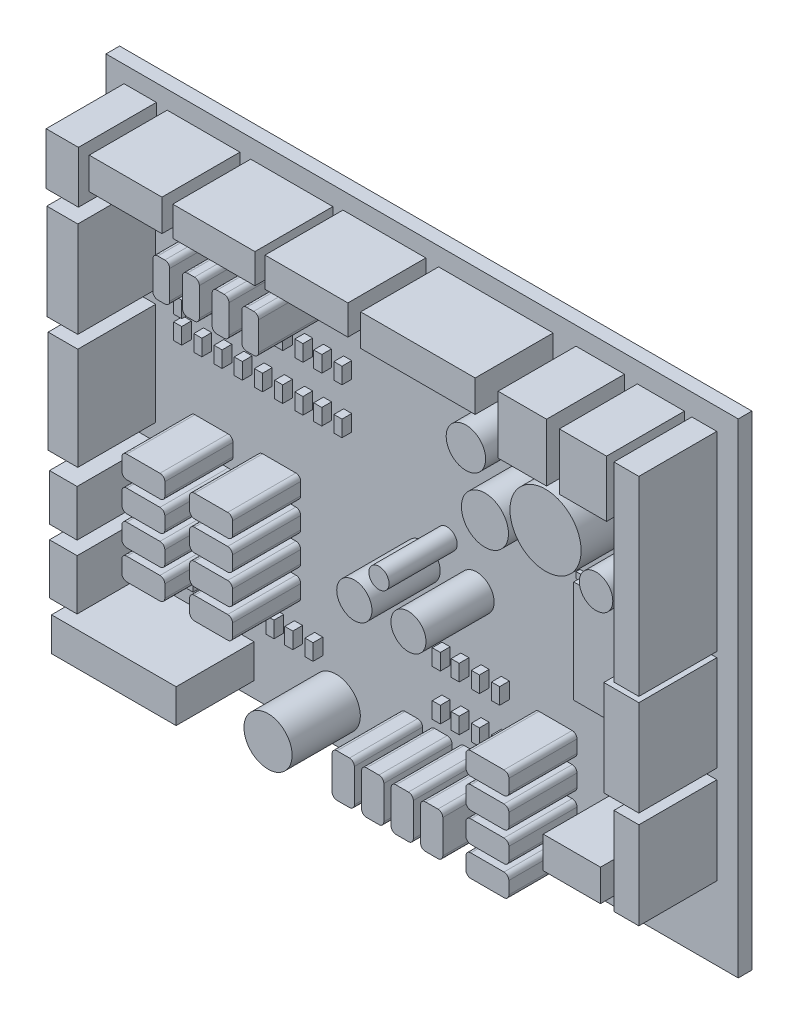
from build123d import *

# Parameters (mm, degrees)
ESQUISSE1_W       = 64.9
ESQUISSE1_H       = 49.7
EXTRUSION1_DEPTH  = 1.4
ESQUISSE2_W       = 3.318632151
ESQUISSE2_H       = 5.323639075
ESQUISSE2_W_2     = 8.503994887
ESQUISSE2_H_2     = 3.042079471
EXTRUSION2_DEPTH  = 8
ESQUISSE3_W       = 7.46692234
ESQUISSE3_H       = 3.249493981
ESQUISSE3_W_2     = 3.180355811
ESQUISSE3_H_2     = 9.817620113
ESQUISSE3_W_3     = 11.753488868
ESQUISSE3_W_4     = 4.977948227
ESQUISSE3_H_3     = 5.945882604
EXTRUSION3_DEPTH  = 8
ESQUISSE4_W       = 8.434856716
ESQUISSE4_H       = 3.042079472
ESQUISSE4_W_2     = 3.042079471
ESQUISSE4_H_2     = 10.509001811
ESQUISSE4_W_3     = 3.595184831
ESQUISSE4_H_3     = 9.817620113
EXTRUSION4_DEPTH  = 8
ESQUISSE5_W       = 2.834664963
ESQUISSE5_H       = 4.770533717
ESQUISSE5_W_2     = 4.839671887
ESQUISSE5_H_2     = 5.807606264
EXTRUSION5_DEPTH  = 8
ESQUISSE6_W       = 2.834664963
ESQUISSE6_H       = 5.185362736
EXTRUSION6_DEPTH  = 8
ESQUISSE7_W       = 2.558112283
ESQUISSE7_H       = 19.566102056
ESQUISSE7_H_2     = 8.987962075
ESQUISSE7_W_2     = 5.876744433
ESQUISSE7_H_3     = 3.249493981
ESQUISSE7_W_3     = 12.790561415
ESQUISSE7_H_4     = 3.456908491
EXTRUSION7_DEPTH  = 8
ESQUISSE8_R       = 2.470952446
ESQUISSE8_R_2     = 3.651254759
ESQUISSE8_R_3     = 2.0241223
ESQUISSE8_R_4     = 2.414892453
ESQUISSE8_R_5     = 1.717356511
ESQUISSE8_R_6     = 1.037072547
ESQUISSE8_R_7     = 1.809519071
ESQUISSE8_R_8     = 1.797592415
EXTRUSION8_DEPTH  = 7
ESQUISSE9_W       = 5.975898327
ESQUISSE9_H       = 10.512512571
EXTRUSION9_DEPTH  = 2
ESQUISSE10_W      = 1.347954655
ESQUISSE10_H      = 0.622243529
ESQUISSE10_H_2    = 0.622243528
EXTRUSION10_DEPTH = 0.4
ESQUISSE11_W      = 0.829658038
ESQUISSE11_H      = 1.659316076
ESQUISSE11_W_2    = 0.829658037
ESQUISSE11_H_2    = 1.659316075
EXTRUSION11_DEPTH = 1


with BuildPart() as part:
    # Esquisse1 → Extrusion1 (new body)
    with BuildSketch(Plane.XY):
        with Locations((32.45, 24.85)):
            Rectangle(ESQUISSE1_W, ESQUISSE1_H)
    extrude(amount=EXTRUSION1_DEPTH)

    # Esquisse2 → Extrusion2 (add)
    with BuildSketch(Plane.XY.offset(1.4)):
        with Locations((3.515675935, 45.314898263)):
            Rectangle(ESQUISSE2_W, ESQUISSE2_H)
        with Locations((28.578262491, 46.455678066)):
            Rectangle(ESQUISSE2_W_2, ESQUISSE2_H_2)
    extrude(amount=EXTRUSION2_DEPTH)

    # Esquisse3 → Extrusion3 (add)
    with BuildSketch(Plane.XY.offset(1.4)):
        with Locations((10.014663897, 46.213694472)):
            Rectangle(ESQUISSE3_W, ESQUISSE3_H)
        with Locations((3.515675934, 36.223228934)):
            Rectangle(ESQUISSE3_W_2, ESQUISSE3_H_2)
        with Locations((40.020629594, 46.213694472)):
            Rectangle(ESQUISSE3_W_3, ESQUISSE3_H)
        with Locations((50.737045915, 44.86550016)):
            Rectangle(ESQUISSE3_W_4, ESQUISSE3_H_3)
    extrude(amount=EXTRUSION3_DEPTH)

    # Esquisse4 → Extrusion4 (add)
    with BuildSketch(Plane.XY.offset(1.4)):
        with Locations((19.071764142, 46.248263556)):
            Rectangle(ESQUISSE4_W, ESQUISSE4_H)
        with Locations((3.584814105, 24.746292745)):
            Rectangle(ESQUISSE4_W_2, ESQUISSE4_H_2)
        with Locations((60.900356877, 22.464733141)):
            Rectangle(ESQUISSE4_W_3, ESQUISSE4_H_3)
    extrude(amount=EXTRUSION4_DEPTH)

    # Esquisse5 → Extrusion5 (add)
    with BuildSketch(Plane.XY.offset(1.4)):
        with Locations((3.61938319, 15.378070736)):
            Rectangle(ESQUISSE5_W, ESQUISSE5_H)
        with Locations((56.959481197, 44.72722382)):
            Rectangle(ESQUISSE5_W_2, ESQUISSE5_H_2)
    extrude(amount=EXTRUSION5_DEPTH)

    # Esquisse6 → Extrusion6 (add)
    with BuildSketch(Plane.XY.offset(1.4)):
        with Locations((3.61938319, 9.017359114)):
            Rectangle(ESQUISSE6_W, ESQUISSE6_H)
    extrude(amount=EXTRUSION6_DEPTH)

    # Esquisse7 → Extrusion7 (add)
    with BuildSketch(Plane.XY.offset(1.4)):
        with Locations((61.418893151, 37.709699585)):
            Rectangle(ESQUISSE7_W, ESQUISSE7_H)
        with Locations((61.418893151, 12.024869501)):
            Rectangle(ESQUISSE7_W, ESQUISSE7_H_2)
        with Locations((55.818701395, 9.155635454)):
            Rectangle(ESQUISSE7_W_2, ESQUISSE7_H_3)
        with Locations((8.804745926, 3.313460104)):
            Rectangle(ESQUISSE7_W_3, ESQUISSE7_H_4)
    extrude(amount=EXTRUSION7_DEPTH)

    # Esquisse8 → Extrusion8 (add)
    with BuildSketch(Plane.XY.offset(1.4)):
        with Locations(Location((23.634883349, 3.898631086, 0), (0, 0, 180))):
            Circle(ESQUISSE8_R)
        with Locations(Location((52.119809311, 36.914610632, 0), (0, 0, 180))):
            Circle(ESQUISSE8_R_2)
        with Locations(Location((43.945472462, 40.164104613, 0), (0, 0, 180))):
            Circle(ESQUISSE8_R_3)
        with Locations(Location((45.897374028, 34.702189198, 0), (0, 0, 180))):
            Circle(ESQUISSE8_R_4)
        with Locations(Location((57.305172046, 34.07994567, 0), (0, 0, 180))):
            Circle(ESQUISSE8_R_5)
        with Locations(Location((35.020629594, 24.124049217, 0), (0, 0, 180))):
            Circle(ESQUISSE8_R_6)
        with Locations(Location((32.494582934, 20.874555236, 0), (0, 0, 180))):
            Circle(ESQUISSE8_R_7)
        with Locations(Location((38.046676254, 20.874555236, 0), (0, 0, 180))):
            Circle(ESQUISSE8_R_8)
        with BuildLine():
            Line((15.354335784, 41.392558858), (16.082790029, 41.392558858))
            ThreePointArc((16.082790029, 41.392558858), (16.436343419, 41.246112249), (16.582790029, 40.892558858))
            Line((16.582790029, 40.892558858), (16.582790029, 37.983748802))
            ThreePointArc((16.582790029, 37.983748802), (16.436343419, 37.630195411), (16.082790029, 37.483748802))
            Line((16.082790029, 37.483748802), (15.354335784, 37.483748802))
            ThreePointArc((15.354335784, 37.483748802), (15.000782393, 37.630195411), (14.854335784, 37.983748802))
            Line((14.854335784, 37.983748802), (14.854335784, 40.892558858))
            ThreePointArc((14.854335784, 40.892558858), (15.000782393, 41.246112249), (15.354335784, 41.392558858))
        make_face()
        with BuildLine():
            Line((12.312256312, 41.392558858), (13.040710557, 41.392558858))
            ThreePointArc((13.040710557, 41.392558858), (13.394263948, 41.246112249), (13.540710557, 40.892558858))
            Line((13.540710557, 40.892558858), (13.540710557, 37.983748802))
            ThreePointArc((13.540710557, 37.983748802), (13.394263948, 37.630195411), (13.040710557, 37.483748802))
            Line((13.040710557, 37.483748802), (12.312256312, 37.483748802))
            ThreePointArc((12.312256312, 37.483748802), (11.958702921, 37.630195411), (11.812256312, 37.983748802))
            Line((11.812256312, 37.983748802), (11.812256312, 40.892558858))
            ThreePointArc((11.812256312, 40.892558858), (11.958702921, 41.246112249), (12.312256312, 41.392558858))
        make_face()
        with BuildLine():
            Line((18.396415255, 41.392558858), (19.1248695, 41.392558858))
            ThreePointArc((19.1248695, 41.392558858), (19.478422891, 41.246112249), (19.6248695, 40.892558858))
            Line((19.6248695, 40.892558858), (19.6248695, 37.983748802))
            ThreePointArc((19.6248695, 37.983748802), (19.478422891, 37.630195411), (19.1248695, 37.483748802))
            Line((19.1248695, 37.483748802), (18.396415255, 37.483748802))
            ThreePointArc((18.396415255, 37.483748802), (18.042861865, 37.630195411), (17.896415255, 37.983748802))
            Line((17.896415255, 37.983748802), (17.896415255, 40.892558858))
            ThreePointArc((17.896415255, 40.892558858), (18.042861865, 41.246112249), (18.396415255, 41.392558858))
        make_face()
        with BuildLine():
            Line((21.438494727, 41.392558858), (22.166948972, 41.392558858))
            ThreePointArc((22.166948972, 41.392558858), (22.520502363, 41.246112249), (22.666948972, 40.892558858))
            Line((22.666948972, 40.892558858), (22.666948972, 37.983748802))
            ThreePointArc((22.666948972, 37.983748802), (22.520502363, 37.630195411), (22.166948972, 37.483748802))
            Line((22.166948972, 37.483748802), (21.438494727, 37.483748802))
            ThreePointArc((21.438494727, 37.483748802), (21.084941336, 37.630195411), (20.938494727, 37.983748802))
            Line((20.938494727, 37.983748802), (20.938494727, 40.892558858))
            ThreePointArc((20.938494727, 40.892558858), (21.084941336, 41.246112249), (21.438494727, 41.392558858))
        make_face()
        with BuildLine():
            Line((8.631900501, 18.662133802), (8.631900501, 17.380574198))
            ThreePointArc((8.631900501, 17.380574198), (8.77834711, 17.027020808), (9.131900501, 16.880574198))
            Line((9.131900501, 16.880574198), (12.540710557, 16.880574198))
            ThreePointArc((12.540710557, 16.880574198), (12.894263948, 17.027020808), (13.040710557, 17.380574198))
            Line((13.040710557, 17.380574198), (13.040710557, 18.662133802))
            ThreePointArc((13.040710557, 18.662133802), (12.894263948, 19.015687193), (12.540710557, 19.162133802))
            Line((12.540710557, 19.162133802), (9.131900501, 19.162133802))
            ThreePointArc((9.131900501, 19.162133802), (8.77834711, 19.015687193), (8.631900501, 18.662133802))
        make_face()
        with BuildLine():
            Line((9.131900501, 22.188180462), (12.540710557, 22.188180462))
            ThreePointArc((12.540710557, 22.188180462), (12.894263948, 22.041733853), (13.040710557, 21.688180462))
            Line((13.040710557, 21.688180462), (13.040710557, 20.406620859))
            ThreePointArc((13.040710557, 20.406620859), (12.894263948, 20.053067468), (12.540710557, 19.906620859))
            Line((12.540710557, 19.906620859), (9.131900501, 19.906620859))
            ThreePointArc((9.131900501, 19.906620859), (8.77834711, 20.053067468), (8.631900501, 20.406620859))
            Line((8.631900501, 20.406620859), (8.631900501, 21.688180462))
            ThreePointArc((8.631900501, 21.688180462), (8.77834711, 22.041733853), (9.131900501, 22.188180462))
        make_face()
        with BuildLine():
            Line((8.631900501, 15.636087142), (8.631900501, 14.354527538))
            ThreePointArc((8.631900501, 14.354527538), (8.77834711, 14.000974147), (9.131900501, 13.854527538))
            Line((9.131900501, 13.854527538), (12.540710557, 13.854527538))
            ThreePointArc((12.540710557, 13.854527538), (12.894263948, 14.000974147), (13.040710557, 14.354527538))
            Line((13.040710557, 14.354527538), (13.040710557, 15.636087142))
            ThreePointArc((13.040710557, 15.636087142), (12.894263948, 15.989640532), (12.540710557, 16.136087142))
            Line((12.540710557, 16.136087142), (9.131900501, 16.136087142))
            ThreePointArc((9.131900501, 16.136087142), (8.77834711, 15.989640532), (8.631900501, 15.636087142))
        make_face()
        with BuildLine():
            Line((8.631900501, 12.610040482), (8.631900501, 11.328480878))
            ThreePointArc((8.631900501, 11.328480878), (8.77834711, 10.974927487), (9.131900501, 10.828480878))
            Line((9.131900501, 10.828480878), (12.540710557, 10.828480878))
            ThreePointArc((12.540710557, 10.828480878), (12.894263948, 10.974927487), (13.040710557, 11.328480878))
            Line((13.040710557, 11.328480878), (13.040710557, 12.610040482))
            ThreePointArc((13.040710557, 12.610040482), (12.894263948, 12.963593872), (12.540710557, 13.110040482))
            Line((12.540710557, 13.110040482), (9.131900501, 13.110040482))
            ThreePointArc((9.131900501, 13.110040482), (8.77834711, 12.963593872), (8.631900501, 12.610040482))
        make_face()
        with BuildLine():
            Line((16.082790029, 19.162133802), (19.491600085, 19.162133802))
            ThreePointArc((19.491600085, 19.162133802), (19.845153476, 19.015687193), (19.991600085, 18.662133802))
            Line((19.991600085, 18.662133802), (19.991600085, 17.380574198))
            ThreePointArc((19.991600085, 17.380574198), (19.845153476, 17.027020808), (19.491600085, 16.880574198))
            Line((19.491600085, 16.880574198), (16.082790029, 16.880574198))
            ThreePointArc((16.082790029, 16.880574198), (15.729236638, 17.027020808), (15.582790029, 17.380574198))
            Line((15.582790029, 17.380574198), (15.582790029, 18.662133802))
            ThreePointArc((15.582790029, 18.662133802), (15.729236638, 19.015687193), (16.082790029, 19.162133802))
        make_face()
        with BuildLine():
            Line((16.082790029, 13.110040482), (19.491600085, 13.110040482))
            ThreePointArc((19.491600085, 13.110040482), (19.845153476, 12.963593872), (19.991600085, 12.610040482))
            Line((19.991600085, 12.610040482), (19.991600085, 11.328480878))
            ThreePointArc((19.991600085, 11.328480878), (19.845153476, 10.974927487), (19.491600085, 10.828480878))
            Line((19.491600085, 10.828480878), (16.082790029, 10.828480878))
            ThreePointArc((16.082790029, 10.828480878), (15.729236638, 10.974927487), (15.582790029, 11.328480878))
            Line((15.582790029, 11.328480878), (15.582790029, 12.610040482))
            ThreePointArc((15.582790029, 12.610040482), (15.729236638, 12.963593872), (16.082790029, 13.110040482))
        make_face()
        with BuildLine():
            Line((19.991600085, 21.688180462), (19.991600085, 20.406620859))
            ThreePointArc((19.991600085, 20.406620859), (19.845153476, 20.053067468), (19.491600085, 19.906620859))
            Line((19.491600085, 19.906620859), (16.082790029, 19.906620859))
            ThreePointArc((16.082790029, 19.906620859), (15.729236638, 20.053067468), (15.582790029, 20.406620859))
            Line((15.582790029, 20.406620859), (15.582790029, 21.688180462))
            ThreePointArc((15.582790029, 21.688180462), (15.729236638, 22.041733853), (16.082790029, 22.188180462))
            Line((16.082790029, 22.188180462), (19.491600085, 22.188180462))
            ThreePointArc((19.491600085, 22.188180462), (19.845153476, 22.041733853), (19.991600085, 21.688180462))
        make_face()
        with BuildLine():
            Line((15.582790029, 15.636087142), (15.582790029, 14.354527538))
            ThreePointArc((15.582790029, 14.354527538), (15.729236638, 14.000974147), (16.082790029, 13.854527538))
            Line((16.082790029, 13.854527538), (19.491600085, 13.854527538))
            ThreePointArc((19.491600085, 13.854527538), (19.845153476, 14.000974147), (19.991600085, 14.354527538))
            Line((19.991600085, 14.354527538), (19.991600085, 15.636087142))
            ThreePointArc((19.991600085, 15.636087142), (19.845153476, 15.989640532), (19.491600085, 16.136087142))
            Line((19.491600085, 16.136087142), (16.082790029, 16.136087142))
            ThreePointArc((16.082790029, 16.136087142), (15.729236638, 15.989640532), (15.582790029, 15.636087142))
        make_face()
        with BuildLine():
            Line((33.23906999, 2.694226057), (33.23906999, 6.103036114))
            ThreePointArc((33.23906999, 6.103036114), (33.3855166, 6.456589504), (33.73906999, 6.603036114))
            Line((33.73906999, 6.603036114), (35.020629594, 6.603036114))
            ThreePointArc((35.020629594, 6.603036114), (35.374182985, 6.456589504), (35.520629594, 6.103036114))
            Line((35.520629594, 6.103036114), (35.520629594, 2.694226057))
            ThreePointArc((35.520629594, 2.694226057), (35.374182985, 2.340672667), (35.020629594, 2.194226057))
            Line((35.020629594, 2.194226057), (33.73906999, 2.194226057))
            ThreePointArc((33.73906999, 2.194226057), (33.3855166, 2.340672667), (33.23906999, 2.694226057))
        make_face()
        with BuildLine():
            Line((39.291163311, 2.694226057), (39.291163311, 6.103036114))
            ThreePointArc((39.291163311, 6.103036114), (39.43760992, 6.456589504), (39.791163311, 6.603036114))
            Line((39.791163311, 6.603036114), (41.072722915, 6.603036114))
            ThreePointArc((41.072722915, 6.603036114), (41.426276305, 6.456589504), (41.572722915, 6.103036114))
            Line((41.572722915, 6.103036114), (41.572722915, 2.694226057))
            ThreePointArc((41.572722915, 2.694226057), (41.426276305, 2.340672667), (41.072722915, 2.194226057))
            Line((41.072722915, 2.194226057), (39.791163311, 2.194226057))
            ThreePointArc((39.791163311, 2.194226057), (39.43760992, 2.340672667), (39.291163311, 2.694226057))
        make_face()
        with BuildLine():
            Line((30.71302333, 6.603036114), (31.994582934, 6.603036114))
            ThreePointArc((31.994582934, 6.603036114), (32.348136324, 6.456589504), (32.494582934, 6.103036114))
            Line((32.494582934, 6.103036114), (32.494582934, 2.694226057))
            ThreePointArc((32.494582934, 2.694226057), (32.348136324, 2.340672667), (31.994582934, 2.194226057))
            Line((31.994582934, 2.194226057), (30.71302333, 2.194226057))
            ThreePointArc((30.71302333, 2.194226057), (30.35946994, 2.340672667), (30.21302333, 2.694226057))
            Line((30.21302333, 2.694226057), (30.21302333, 6.103036114))
            ThreePointArc((30.21302333, 6.103036114), (30.35946994, 6.456589504), (30.71302333, 6.603036114))
        make_face()
        with BuildLine():
            Line((36.765116651, 2.194226057), (38.046676254, 2.194226057))
            ThreePointArc((38.046676254, 2.194226057), (38.400229645, 2.340672667), (38.546676254, 2.694226057))
            Line((38.546676254, 2.694226057), (38.546676254, 6.103036114))
            ThreePointArc((38.546676254, 6.103036114), (38.400229645, 6.456589504), (38.046676254, 6.603036114))
            Line((38.046676254, 6.603036114), (36.765116651, 6.603036114))
            ThreePointArc((36.765116651, 6.603036114), (36.41156326, 6.456589504), (36.265116651, 6.103036114))
            Line((36.265116651, 6.103036114), (36.265116651, 2.694226057))
            ThreePointArc((36.265116651, 2.694226057), (36.41156326, 2.340672667), (36.765116651, 2.194226057))
        make_face()
        with BuildLine():
            Line((44.445472462, 10.450724406), (47.854282518, 10.450724406))
            ThreePointArc((47.854282518, 10.450724406), (48.207835909, 10.304277797), (48.354282518, 9.950724406))
            Line((48.354282518, 9.950724406), (48.354282518, 8.669164802))
            ThreePointArc((48.354282518, 8.669164802), (48.207835909, 8.315611412), (47.854282518, 8.169164802))
            Line((47.854282518, 8.169164802), (44.445472462, 8.169164802))
            ThreePointArc((44.445472462, 8.169164802), (44.091919071, 8.315611412), (43.945472462, 8.669164802))
            Line((43.945472462, 8.669164802), (43.945472462, 9.950724406))
            ThreePointArc((43.945472462, 9.950724406), (44.091919071, 10.304277797), (44.445472462, 10.450724406))
        make_face()
        with BuildLine():
            Line((44.445472462, 4.398631086), (47.854282518, 4.398631086))
            ThreePointArc((47.854282518, 4.398631086), (48.207835909, 4.252184476), (48.354282518, 3.898631086))
            Line((48.354282518, 3.898631086), (48.354282518, 2.617071482))
            ThreePointArc((48.354282518, 2.617071482), (48.207835909, 2.263518091), (47.854282518, 2.117071482))
            Line((47.854282518, 2.117071482), (44.445472462, 2.117071482))
            ThreePointArc((44.445472462, 2.117071482), (44.091919071, 2.263518091), (43.945472462, 2.617071482))
            Line((43.945472462, 2.617071482), (43.945472462, 3.898631086))
            ThreePointArc((43.945472462, 3.898631086), (44.091919071, 4.252184476), (44.445472462, 4.398631086))
        make_face()
        with BuildLine():
            Line((48.354282518, 12.976771066), (48.354282518, 11.695211463))
            ThreePointArc((48.354282518, 11.695211463), (48.207835909, 11.341658072), (47.854282518, 11.195211463))
            Line((47.854282518, 11.195211463), (44.445472462, 11.195211463))
            ThreePointArc((44.445472462, 11.195211463), (44.091919071, 11.341658072), (43.945472462, 11.695211463))
            Line((43.945472462, 11.695211463), (43.945472462, 12.976771066))
            ThreePointArc((43.945472462, 12.976771066), (44.091919071, 13.330324457), (44.445472462, 13.476771066))
            Line((44.445472462, 13.476771066), (47.854282518, 13.476771066))
            ThreePointArc((47.854282518, 13.476771066), (48.207835909, 13.330324457), (48.354282518, 12.976771066))
        make_face()
        with BuildLine():
            Line((43.945472462, 6.924677746), (43.945472462, 5.643118142))
            ThreePointArc((43.945472462, 5.643118142), (44.091919071, 5.289564752), (44.445472462, 5.143118142))
            Line((44.445472462, 5.143118142), (47.854282518, 5.143118142))
            ThreePointArc((47.854282518, 5.143118142), (48.207835909, 5.289564752), (48.354282518, 5.643118142))
            Line((48.354282518, 5.643118142), (48.354282518, 6.924677746))
            ThreePointArc((48.354282518, 6.924677746), (48.207835909, 7.278231136), (47.854282518, 7.424677746))
            Line((47.854282518, 7.424677746), (44.445472462, 7.424677746))
            ThreePointArc((44.445472462, 7.424677746), (44.091919071, 7.278231136), (43.945472462, 6.924677746))
        make_face()
    extrude(amount=EXTRUSION8_DEPTH)

    # Esquisse9 → Extrusion9 (add)
    with BuildSketch(Plane.XY.offset(1.4)):
        with Locations((52.998804639, 23.511126475)):
            Rectangle(ESQUISSE9_W, ESQUISSE9_H)
    extrude(amount=EXTRUSION9_DEPTH)

    # Esquisse10 → Extrusion10 (add)
    with BuildSketch(Plane.XY.offset(1.4)):
        with Locations((49.336878148, 27.892079472)):
            Rectangle(ESQUISSE10_W, ESQUISSE10_H)
        with Locations((49.336878148, 26.509316076)):
            Rectangle(ESQUISSE10_W, ESQUISSE10_H)
        with Locations((49.336878148, 25.126552679)):
            Rectangle(ESQUISSE10_W, ESQUISSE10_H_2)
        with Locations((49.336878148, 23.743789283)):
            Rectangle(ESQUISSE10_W, ESQUISSE10_H_2)
        with Locations((49.336878148, 22.361025887)):
            Rectangle(ESQUISSE10_W, ESQUISSE10_H_2)
        with Locations((49.336878148, 20.978262491)):
            Rectangle(ESQUISSE10_W, ESQUISSE10_H_2)
        with Locations((49.336878148, 19.595499094)):
            Rectangle(ESQUISSE10_W, ESQUISSE10_H)
        with Locations((56.66073113, 19.595499094)):
            Rectangle(ESQUISSE10_W, ESQUISSE10_H)
        with Locations((56.66073113, 20.978262491)):
            Rectangle(ESQUISSE10_W, ESQUISSE10_H_2)
        with Locations((56.66073113, 22.361025887)):
            Rectangle(ESQUISSE10_W, ESQUISSE10_H_2)
        with Locations((56.66073113, 23.743789283)):
            Rectangle(ESQUISSE10_W, ESQUISSE10_H_2)
        with Locations((56.66073113, 25.126552679)):
            Rectangle(ESQUISSE10_W, ESQUISSE10_H_2)
        with Locations((56.66073113, 26.509316076)):
            Rectangle(ESQUISSE10_W, ESQUISSE10_H)
        with Locations((56.66073113, 27.892079472)):
            Rectangle(ESQUISSE10_W, ESQUISSE10_H)
    extrude(amount=EXTRUSION10_DEPTH)

    # Esquisse11 → Extrusion11 (add)
    with BuildSketch(Plane.XY.offset(1.4)):
        with Locations((10.429492916, 34.218222009)):
            Rectangle(ESQUISSE11_W, ESQUISSE11_H)
        with Locations((8.355347822, 34.218222009)):
            Rectangle(ESQUISSE11_W_2, ESQUISSE11_H)
        with Locations((12.50363801, 34.218222009)):
            Rectangle(ESQUISSE11_W, ESQUISSE11_H)
        with Locations((14.577783104, 34.218222009)):
            Rectangle(ESQUISSE11_W, ESQUISSE11_H)
        with Locations((16.651928199, 34.218222009)):
            Rectangle(ESQUISSE11_W_2, ESQUISSE11_H)
        with Locations((18.726073293, 34.218222009)):
            Rectangle(ESQUISSE11_W, ESQUISSE11_H)
        with Locations((20.800218387, 34.218222009)):
            Rectangle(ESQUISSE11_W, ESQUISSE11_H)
        with Locations((8.355347822, 31.867524236)):
            Rectangle(ESQUISSE11_W_2, ESQUISSE11_H_2)
        with Locations((8.355347822, 29.516826462)):
            Rectangle(ESQUISSE11_W_2, ESQUISSE11_H)
        with Locations((10.429492916, 29.516826462)):
            Rectangle(ESQUISSE11_W, ESQUISSE11_H)
        with Locations((12.50363801, 29.516826462)):
            Rectangle(ESQUISSE11_W, ESQUISSE11_H)
        with Locations((14.577783104, 29.516826462)):
            Rectangle(ESQUISSE11_W, ESQUISSE11_H)
        with Locations((16.651928199, 29.516826462)):
            Rectangle(ESQUISSE11_W_2, ESQUISSE11_H)
        with Locations((18.726073293, 29.516826462)):
            Rectangle(ESQUISSE11_W, ESQUISSE11_H)
        with Locations((20.800218387, 29.516826462)):
            Rectangle(ESQUISSE11_W, ESQUISSE11_H)
        with Locations((22.736087142, 29.516826462)):
            Rectangle(ESQUISSE11_W, ESQUISSE11_H)
        with Locations((22.736087142, 34.218222009)):
            Rectangle(ESQUISSE11_W, ESQUISSE11_H)
        with Locations((34.904405028, 9.121066369)):
            Rectangle(ESQUISSE11_W, ESQUISSE11_H_2)
        with Locations((24.810232236, 29.516826462)):
            Rectangle(ESQUISSE11_W, ESQUISSE11_H)
        with Locations((24.810232236, 34.218222009)):
            Rectangle(ESQUISSE11_W, ESQUISSE11_H)
        with Locations((34.904405028, 13.822461915)):
            Rectangle(ESQUISSE11_W, ESQUISSE11_H_2)
        with Locations((36.840273783, 9.121066369)):
            Rectangle(ESQUISSE11_W, ESQUISSE11_H_2)
        with Locations((36.840273783, 13.822461915)):
            Rectangle(ESQUISSE11_W, ESQUISSE11_H_2)
        with Locations((40.988563971, 9.121066369)):
            Rectangle(ESQUISSE11_W_2, ESQUISSE11_H_2)
        with Locations((38.914418877, 9.121066369)):
            Rectangle(ESQUISSE11_W, ESQUISSE11_H_2)
        with Locations((38.914418877, 13.822461915)):
            Rectangle(ESQUISSE11_W, ESQUISSE11_H_2)
        with Locations((40.988563971, 13.822461915)):
            Rectangle(ESQUISSE11_W_2, ESQUISSE11_H_2)
        with Locations((51.912394801, 4.488808991)):
            Rectangle(ESQUISSE11_W, ESQUISSE11_H)
        with Locations((53.848263556, 4.488808991)):
            Rectangle(ESQUISSE11_W, ESQUISSE11_H)
        with Locations((55.92240865, 4.488808991)):
            Rectangle(ESQUISSE11_W, ESQUISSE11_H)
        with Locations((57.996553745, 4.488808991)):
            Rectangle(ESQUISSE11_W_2, ESQUISSE11_H)
        with Locations((9.530696708, 8.153131991)):
            Rectangle(ESQUISSE11_W, ESQUISSE11_H)
        with Locations((11.604841803, 8.153131991)):
            Rectangle(ESQUISSE11_W_2, ESQUISSE11_H)
        with Locations((13.678986897, 8.153131991)):
            Rectangle(ESQUISSE11_W, ESQUISSE11_H)
        with Locations((15.753131991, 8.153131991)):
            Rectangle(ESQUISSE11_W, ESQUISSE11_H)
        with Locations((17.827277085, 8.153131991)):
            Rectangle(ESQUISSE11_W, ESQUISSE11_H)
        with Locations((19.76314584, 8.153131991)):
            Rectangle(ESQUISSE11_W, ESQUISSE11_H)
        with Locations((21.837290934, 8.153131991)):
            Rectangle(ESQUISSE11_W, ESQUISSE11_H)
    extrude(amount=EXTRUSION11_DEPTH)


solid = part.part
